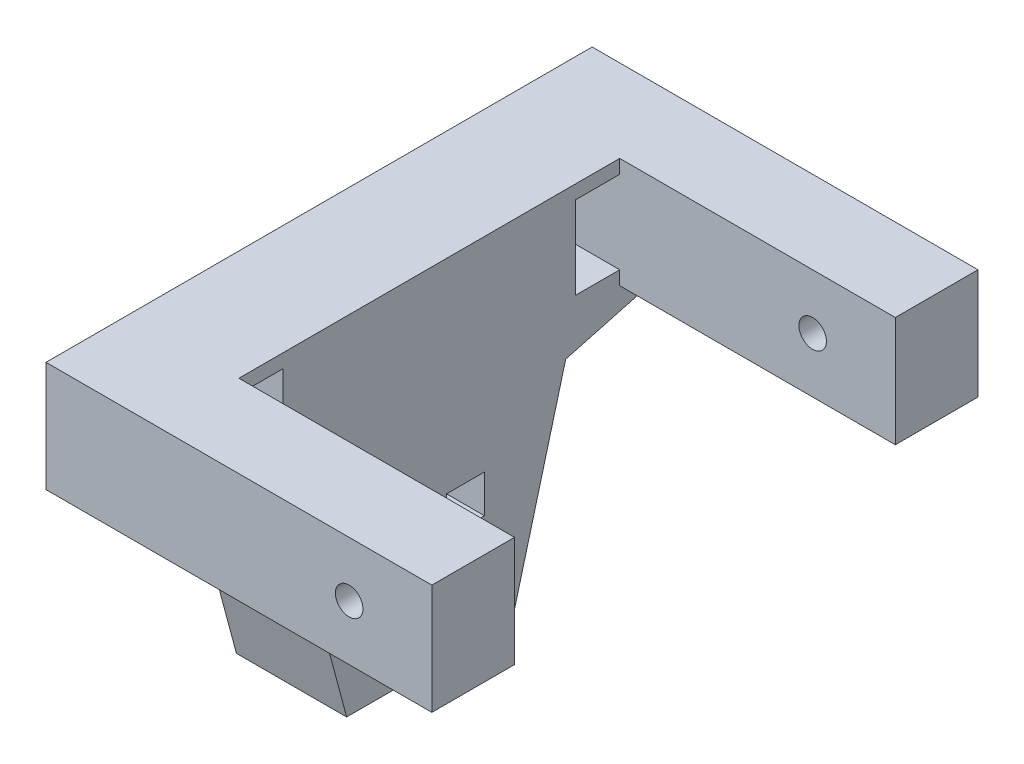
from build123d import *

# Parameters (mm, degrees)
BOSS_EXTRUDE1_DEPTH = 20
CUT_EXTRUDE1_DEPTH  = 20
SKETCH4_W           = 15
SKETCH4_H           = 20
BOSS_EXTRUDE2_DEPTH = 50
SKETCH5_R           = 2.5
CUT_EXTRUDE2_DEPTH  = 137.703431193
SKETCH6_W           = 8
SKETCH6_H           = 15
CUT_EXTRUDE3_DEPTH  = 95.465374741
CUT_EXTRUDE4_DEPTH  = 95.465374741


with BuildPart() as part:
    # Sketch1 → Boss-Extrude1 (new body)
    with BuildSketch(Plane(origin=(0, 0, 0), x_dir=(0, 0, -1), z_dir=(1, 0, 0))):
        Polygon((15, 0), (-15, 0), (-49.545, 31.5), (-49.545, 63), (49.545, 63), (49.545, 31.5), align=None)
    extrude(amount=BOSS_EXTRUDE1_DEPTH)

    # Sketch3 → Cut-Extrude1 (cut)
    with BuildSketch(Plane(origin=(20, 0, 0), x_dir=(0, 0, -1), z_dir=(1, 0, 0))):
        Polygon((-10, 12.875), (-10, 6), (-3.125, 6), (-3.125, 8), (-4, 8), (-4, 10), (4, 10), (4, 8), (3.125, 8), (3.125, 6), (10, 6), (10, 12.875), (8, 12.875), (8, 12), (6, 12), (6, 20), (8, 20), (8, 19.125), (10, 19.125), (10, 26), (3.125, 26), (3.125, 24), (4, 24), (4, 22), (-4, 22), (-4, 24), (-3.125, 24), (-3.125, 26), (-10, 26), (-10, 19.125), (-8, 19.125), (-8, 20), (-6, 20), (-6, 12), (-8, 12), (-8, 12.875), align=None)
    extrude(amount=-CUT_EXTRUDE1_DEPTH, mode=Mode.SUBTRACT)

    # Sketch4 → Boss-Extrude2 (add)
    with BuildSketch(Plane(origin=(20, 0, 0), x_dir=(0, 0, -1), z_dir=(1, 0, 0))):
        with Locations((-42.045, 53)):
            Rectangle(SKETCH4_W, SKETCH4_H)
        with Locations((42.040757, 53)):
            Rectangle(SKETCH4_W, SKETCH4_H)
    extrude(amount=BOSS_EXTRUDE2_DEPTH)

    # Sketch5 → Cut-Extrude2 (cut, through all)
    with BuildSketch(Plane.XY.offset(49.545)):
        with Locations((55, 53)):
            Circle(SKETCH5_R)
    extrude(amount=-CUT_EXTRUDE2_DEPTH, mode=Mode.SUBTRACT)

    # Sketch6 → Cut-Extrude3 (cut, through all)
    with BuildSketch(Plane(origin=(20, 0, 0), x_dir=(0, 0, -1), z_dir=(1, 0, 0))):
        with Locations((-30.545, 53)):
            Rectangle(SKETCH6_W, SKETCH6_H)
        with Locations((30.540757, 53)):
            Rectangle(SKETCH6_W, SKETCH6_H)
    extrude(amount=-CUT_EXTRUDE3_DEPTH, mode=Mode.SUBTRACT)

    # Sketch7 → Cut-Extrude4 (cut, through all)
    with BuildSketch(Plane(origin=(20, 0, 0), x_dir=(0, 0, -1), z_dir=(1, 0, 0))):
        Polygon((-49.545, 43), (-24.740965738, 36.353779051), (-15, 0), (-52.774772494, 23.355056254), align=None)
        Polygon((49.540757, 43), (24.740965738, 36.353779051), (15, 0), (56.193227383, 18.176889525), align=None)
    extrude(amount=-CUT_EXTRUDE4_DEPTH, mode=Mode.SUBTRACT)


solid = part.part
